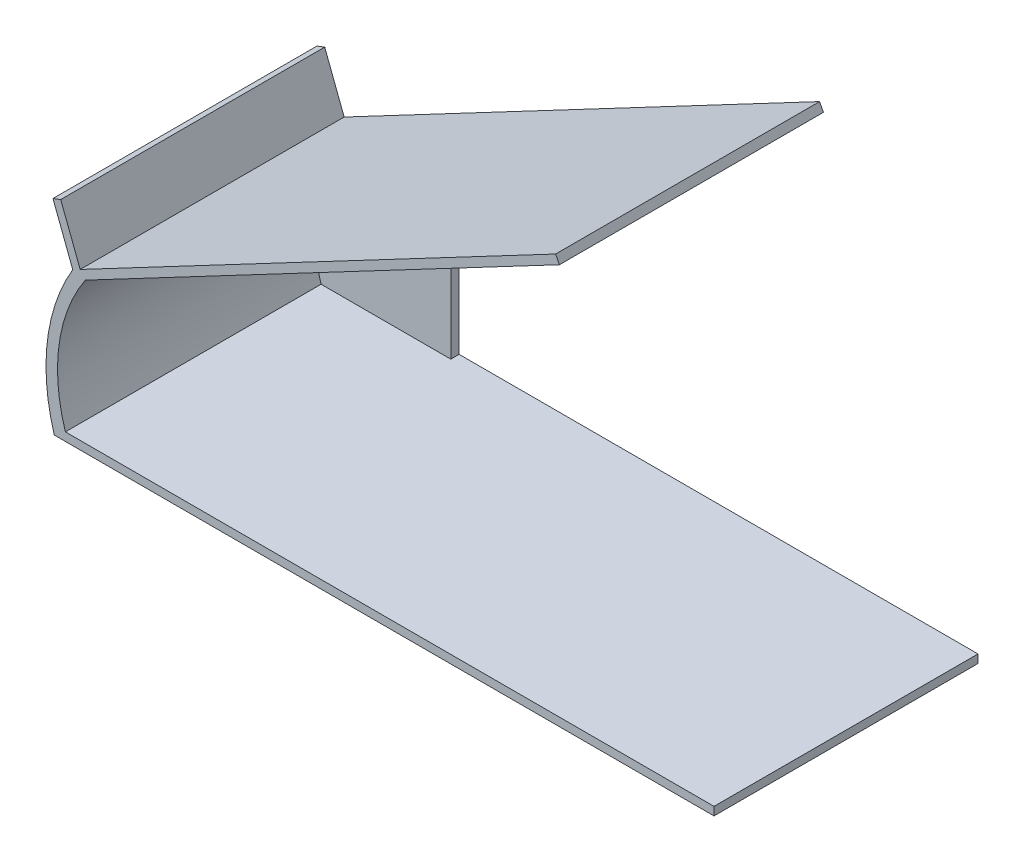
from build123d import *

# Parameters (mm, degrees)
BOSS_EXTRUDE1_DEPTH = 95.25
BOSS_EXTRUDE2_DEPTH = 3
BOSS_EXTRUDE3_DEPTH = 95.25


with BuildPart() as part:
    # Sketch1 → Boss-Extrude1 (new body)
    with BuildSketch(Plane.XY):
        with BuildLine():
            Line((241, 0), (3, 0))
            ThreePointArc((3, 0), (0.493692681, 28.205363915), (9.651836979, 55))
            Line((9.651836979, 55), (183.85, 147))
            Line((183.85, 147), (185.251015228, 144.347236096))
            Line((185.251015228, 144.347236096), (14.182291728, 54))
            ThreePointArc((14.182291728, 54), (4.732417832, 29.325080272), (7, 3))
            Line((7, 3), (241, 3))
            Line((241, 3), (241, 0))
        make_face()
    extrude(amount=BOSS_EXTRUDE1_DEPTH)

    # Sketch2 → Boss-Extrude2 (add)
    with BuildSketch(Plane(origin=(0, 0, 0), x_dir=(-1, 0, 0), z_dir=(0, 0, -1))):
        with BuildLine():
            Line((-53.8, 78.316152866), (-53.8, 0))
            Line((-53.8, 0), (-3, 0))
            ThreePointArc((-3, 0), (-0.493692681, 28.205363915), (-9.651836979, 55))
            Line((-9.651836979, 55), (-53.8, 78.316152866))
        make_face()
    extrude(amount=-BOSS_EXTRUDE2_DEPTH)

    # Sketch3 → Boss-Extrude3 (add)
    with BuildSketch(Plane(origin=(0, 0, 0), x_dir=(-1, 0, 0), z_dir=(0, 0, -1))):
        Polygon((-9.651836979, 55), (-2.507196918, 73.680313659), (-5.309243966, 74.752009668), (-12.324009257, 56.411265454), align=None)
    extrude(amount=-BOSS_EXTRUDE3_DEPTH)


solid = part.part
